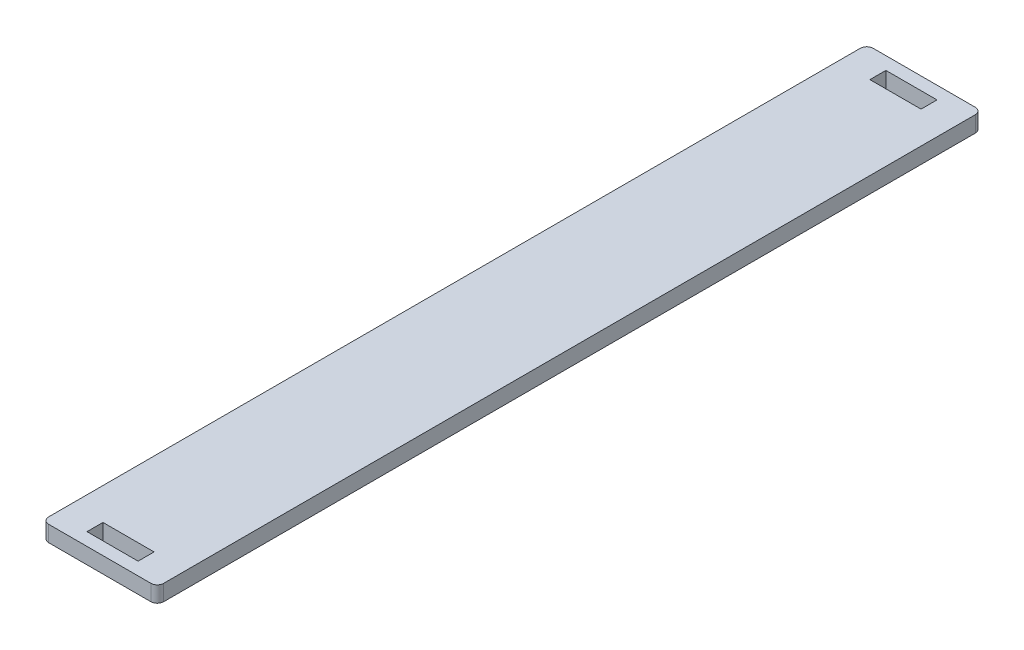
from build123d import *

# Parameters (mm, degrees)
SKETCH1_W           = 18
SKETCH1_H           = 129
SKETCH1_W_2         = 8
SKETCH1_H_2         = 2.5
BOSS_EXTRUDE1_DEPTH = 2.5
FILLET1_R           = 1


with BuildPart() as part:
    # Sketch1 → Boss-Extrude1 (new body)
    with BuildSketch(Plane(origin=(0, 0, 0), x_dir=(1, 0, 0), z_dir=(0, 1, 0))):
        Rectangle(SKETCH1_W, SKETCH1_H)
        with Locations((0, 61.25)):
            Rectangle(SKETCH1_W_2, SKETCH1_H_2, mode=Mode.SUBTRACT)
        with Locations((0, -61.25)):
            Rectangle(SKETCH1_W_2, SKETCH1_H_2, mode=Mode.SUBTRACT)
    extrude(amount=BOSS_EXTRUDE1_DEPTH)

    # Fillet1
    fillet1_edges = [part.edges().sort_by_distance(p)[0] for p in [
        (9, 1.25, 64.5),
        (-9, 1.25, 64.5),
        (-9, 1.25, -64.5),
        (9, 1.25, -64.5),
    ]]
    fillet(fillet1_edges, radius=FILLET1_R)


solid = part.part
